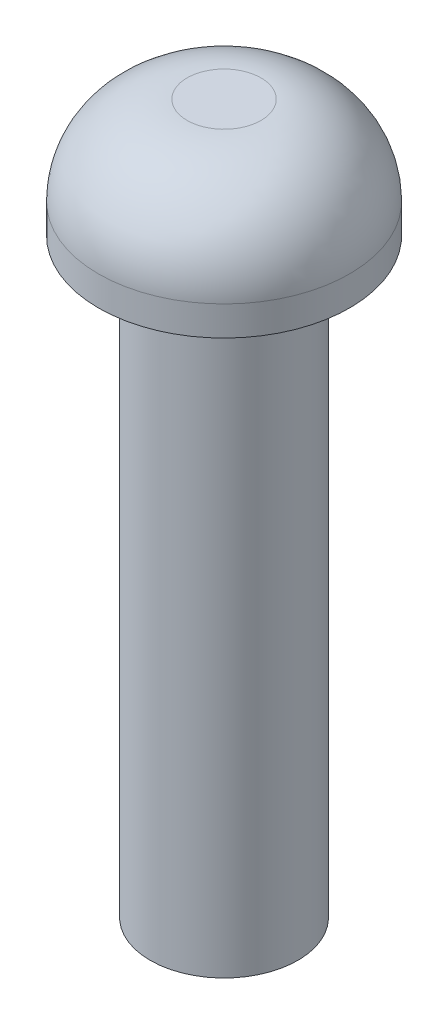
from build123d import *

# Parameters (mm, degrees)
CROQUIS1_R              = 2.5
SALIENTE_EXTRUIR1_DEPTH = 20
CROQUIS2_R              = 4.25
SALIENTE_EXTRUIR2_DEPTH = 4
REDONDEO1_R             = 3


with BuildPart() as part:
    # Croquis1 → Saliente-Extruir1 (new body)
    with BuildSketch(Plane(origin=(0, 0, 0), x_dir=(1, 0, 0), z_dir=(0, 1, 0))):
        with Locations(Location((0, 0, 0), (0, 0, 270))):
            Circle(CROQUIS1_R)
    extrude(amount=SALIENTE_EXTRUIR1_DEPTH)

    # Croquis2 → Saliente-Extruir2 (add)
    with BuildSketch(Plane(origin=(0, 20, 0), x_dir=(1, 0, 0), z_dir=(0, 1, 0))):
        with Locations(Location((0, 0, 0), (0, 0, 270))):
            Circle(CROQUIS2_R)
    extrude(amount=SALIENTE_EXTRUIR2_DEPTH)

    # Redondeo1
    redondeo1_edges = [part.edges().sort_by_distance(p)[0] for p in [
        (0, 24, -4.25),
    ]]
    fillet(redondeo1_edges, radius=REDONDEO1_R)


solid = part.part
